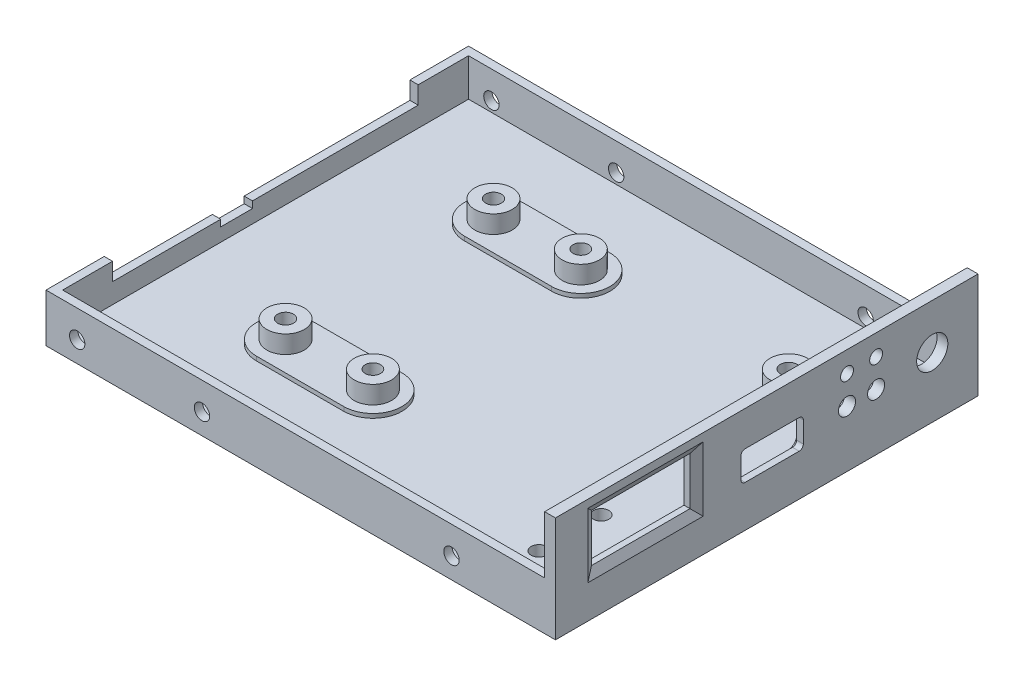
from build123d import *

# Parameters (mm, degrees)
SKETCH_1_W             = 122.5
SKETCH_1_H             = 101.6
EXTRUDE_1_DEPTH        = 25.4
SKETCH_2_W             = 117.9
SKETCH_2_H             = 97.6
CUT_EXTRUDE_1_DEPTH    = 22.857
CUT_EXTRUDE_2_REACH    = 133.758
SKETCH_5_W             = 119.9
SKETCH_5_H             = 13.8
CUT_EXTRUDE_3_REACH    = 142.716
SKETCH_6_W             = 73.5
SKETCH_6_H             = 4.25
CUT_EXTRUDE_4_REACH    = 142.716
SKETCH_7_W             = 7.65
SKETCH_7_H             = 1.6
CUT_EXTRUDE_5_REACH    = 133.758
SKETCH_8_R             = 1.85
EXTRUDE_2_DEPTH        = 1
SKETCH_11_R            = 4.5
EXTRUDE_3_DEPTH        = 4.3
CUT_EXTRUDE_6_REACH    = 106.165
SKETCH_13_R            = 1.85
SKETCH_14_R            = 4.5
SKETCH_14_R_2          = 2
EXTRUDE_5_DEPTH        = 5.3
SKETCH_15_R            = 1.55
SKETCH_15_R_2          = 2.05
CUT_EXTRUDE_7_DEPTH    = 5.3
SKETCH_16_W            = 15
SKETCH_16_H            = 7
CUT_EXTRUDE_8_DEPTH    = 5.3
FILLET_1_R             = 1
SKETCH_17_W            = 23.7
SKETCH_17_H            = 11.5
CUT_EXTRUDE_9_DEPTH    = 5.3
CHAMFER_2_SIZE         = 2
CHAMFER_2_SIZE2        = 1.154700538
SKETCH_12_R            = 1.9
CUT_EXTRUDE_10_DEPTH   = 7.843
CUT_EXTRUDE_START      = -2.543
SKETCH_18_R            = 2
CUT_EXTRUDE_11_DEPTH   = 2.543
SKETCH_19_R            = 3.75
CUT_EXTRUDE_12_DEPTH   = 10
PATTERN_LINEAR_1_COUNT = 2
PATTERN_LINEAR_1_PITCH = 50
SKETCH_30_R            = 1.85
CUT_EXTRUDE_17_DEPTH   = 10
CHAMFER_3_SIZE         = 1


with BuildPart() as part:
    # 草图1 → 凸台-拉伸1 (new body)
    with BuildSketch(Plane(origin=(0, 0, 0), x_dir=(1, 0, 0), z_dir=(0, 1, 0))):
        with Locations((-18.703264605, -13.616494845)):
            Rectangle(SKETCH_1_W, SKETCH_1_H)
    extrude(amount=EXTRUDE_1_DEPTH)

    # 草图2 → 切除-拉伸1 (cut)
    with BuildSketch(Plane(origin=(0, 25.4, 0), x_dir=(1, 0, 0), z_dir=(0, 1, 0))):
        with Locations((-19.003264605, -13.616494845)):
            Rectangle(SKETCH_2_W, SKETCH_2_H)
    extrude(amount=-CUT_EXTRUDE_1_DEPTH, mode=Mode.SUBTRACT)

    # 草图5 → 切除-拉伸2 (cut, up to next)
    with BuildSketch(Plane(origin=(0, 0, -37.183505155), x_dir=(-1, 0, 0), z_dir=(0, 0, -1)), mode=Mode.PRIVATE) as cut_extrude_2_sk1:
        with Locations((20.003264605, 18.5)):
            Rectangle(SKETCH_5_W, SKETCH_5_H)
    cut_extrude_2_tool1 = extrude(cut_extrude_2_sk1.sketch, amount=-CUT_EXTRUDE_2_REACH, mode=Mode.PRIVATE) & part.part
    add(cut_extrude_2_tool1.solids().sort_by_distance((-20.003265, 18.5, -37.183505))[0], mode=Mode.SUBTRACT)

    # 草图6 → 切除-拉伸3 (cut, up to next)
    with BuildSketch(Plane.ZY.offset(79.953264605), mode=Mode.PRIVATE) as cut_extrude_3_sk1:
        with Locations((13.666494845, 9.475)):
            Rectangle(SKETCH_6_W, SKETCH_6_H)
    cut_extrude_3_tool1 = extrude(cut_extrude_3_sk1.sketch, amount=-CUT_EXTRUDE_3_REACH, mode=Mode.PRIVATE) & part.part
    add(cut_extrude_3_tool1.solids().sort_by_distance((-79.953265, 9.475, 13.666495))[0], mode=Mode.SUBTRACT)

    # 草图7 → 切除-拉伸4 (cut, up to next)
    with BuildSketch(Plane.ZY.offset(79.953264605), mode=Mode.PRIVATE) as cut_extrude_4_sk1:
        with Locations((20.591494845, 6.55)):
            Rectangle(SKETCH_7_W, SKETCH_7_H)
    cut_extrude_4_tool1 = extrude(cut_extrude_4_sk1.sketch, amount=-CUT_EXTRUDE_4_REACH, mode=Mode.PRIVATE) & part.part
    add(cut_extrude_4_tool1.solids().sort_by_distance((-79.953265, 6.55, 20.591495))[0], mode=Mode.SUBTRACT)

    # 草图8 → 切除-拉伸5 (cut, up to next)
    with BuildSketch(Plane.XY.offset(64.416494845), mode=Mode.PRIVATE) as cut_extrude_5_sk1:
        with Locations((17.546735395, 5)):
            Circle(SKETCH_8_R)
    cut_extrude_5_tool1 = extrude(cut_extrude_5_sk1.sketch, amount=-CUT_EXTRUDE_5_REACH, mode=Mode.PRIVATE) & part.part
    # 草图8 → 切除-拉伸5 (cut, up to next)
    with BuildSketch(Plane.XY.offset(64.416494845), mode=Mode.PRIVATE) as cut_extrude_5_sk2:
        with Locations((-42.453264605, 5)):
            Circle(SKETCH_8_R)
    cut_extrude_5_tool2 = extrude(cut_extrude_5_sk2.sketch, amount=-CUT_EXTRUDE_5_REACH, mode=Mode.PRIVATE) & part.part
    # 草图8 → 切除-拉伸5 (cut, up to next)
    with BuildSketch(Plane.XY.offset(64.416494845), mode=Mode.PRIVATE) as cut_extrude_5_sk3:
        with Locations((-72.453264605, 5)):
            Circle(SKETCH_8_R)
    cut_extrude_5_tool3 = extrude(cut_extrude_5_sk3.sketch, amount=-CUT_EXTRUDE_5_REACH, mode=Mode.PRIVATE) & part.part
    cut_extrude_5_1 = cut_extrude_5_tool1.solids().sort_by_distance((17.546735, 5, 64.416495))[0]
    add(cut_extrude_5_1, mode=Mode.SUBTRACT)
    cut_extrude_5_2 = cut_extrude_5_tool2.solids().sort_by_distance((-42.453265, 5, 64.416495))[0]
    add(cut_extrude_5_2, mode=Mode.SUBTRACT)
    cut_extrude_5_3 = cut_extrude_5_tool3.solids().sort_by_distance((-72.453265, 5, 64.416495))[0]
    add(cut_extrude_5_3, mode=Mode.SUBTRACT)
    cut_extrude_5 = cut_extrude_5_1 + cut_extrude_5_2 + cut_extrude_5_3  # 切除-拉伸5 as one shape, for the pattern or mirror that repeats it

    # 镜向1: 切除-拉伸5 across plane
    add(cut_extrude_5.mirror(Plane.XY.offset(13.616494845)), mode=Mode.SUBTRACT)

    # 草图10 → 凸台-拉伸2 (add)
    with BuildSketch(Plane(origin=(0, 2.543, 0), x_dir=(1, 0, 0), z_dir=(0, 1, 0))):
        with BuildLine():
            Line((-48.953264605, 19.183505155), (-27.953264605, 19.183505155))
            ThreePointArc((-27.953264605, 19.183505155), (-20.953264605, 12.183505155), (-27.953264605, 5.183505155))
            Line((-27.953264605, 5.183505155), (-48.953264605, 5.183505155))
            ThreePointArc((-48.953264605, 5.183505155), (-55.953264605, 12.183505155), (-48.953264605, 19.183505155))
        make_face()
    extrude_2 = extrude(amount=EXTRUDE_2_DEPTH)

    # 草图11 → 凸台-拉伸3 (add)
    with BuildSketch(Plane(origin=(0, 3.543, 0), x_dir=(1, 0, 0), z_dir=(0, 1, 0))):
        with Locations(Location((-48.953264605, 12.183505155, 0), (0, 0, 90))):
            Circle(SKETCH_11_R)
        with Locations(Location((-27.953264605, 12.183505155, 0), (0, 0, 90))):
            Circle(SKETCH_11_R)
    extrude_3 = extrude(amount=EXTRUDE_3_DEPTH)

    # 草图13 → 切除-拉伸6 (cut, up to next)
    with BuildSketch(Plane(origin=(0, 7.843, 0), x_dir=(1, 0, 0), z_dir=(0, 1, 0)), mode=Mode.PRIVATE) as cut_extrude_6_sk1:
        with Locations(Location((-27.953264605, 12.183505155, 0), (0, 0, 270))):
            Circle(SKETCH_13_R)
    cut_extrude_6_tool1 = extrude(cut_extrude_6_sk1.sketch, amount=-CUT_EXTRUDE_6_REACH, mode=Mode.PRIVATE) & part.part
    cut_extrude_6 = cut_extrude_6_tool1.solids().sort_by_distance((-27.953265, 7.843, -12.183505))[0]
    add(cut_extrude_6, mode=Mode.SUBTRACT)

    # 草图14 → 凸台-拉伸5 (add)
    with BuildSketch(Plane(origin=(0, 2.543, 0), x_dir=(1, 0, 0), z_dir=(0, 1, 0))):
        with Locations(Location((22.046735395, 12.183505155, 0), (0, 0, 270))):
            Circle(SKETCH_14_R)
        with Locations(Location((22.046735395, 12.183505155, 0), (0, 0, 270))):
            Circle(SKETCH_14_R_2, mode=Mode.SUBTRACT)
    extrude(amount=EXTRUDE_5_DEPTH)

    # 草图15 → 切除-拉伸7 (cut)
    with BuildSketch(Plane(origin=(42.546735395, 0, 0), x_dir=(0, 0, -1), z_dir=(1, 0, 0))):
        with Locations((12.683505155, 20.4)):
            Circle(SKETCH_15_R)
        with Locations((12.683505155, 13.6)):
            Circle(SKETCH_15_R_2)
        with Locations((5.683505155, 20.4)):
            Circle(SKETCH_15_R)
        with Locations((5.683505155, 13.6)):
            Circle(SKETCH_15_R_2)
    extrude(amount=-CUT_EXTRUDE_7_DEPTH, mode=Mode.SUBTRACT)

    # 草图16 → 切除-拉伸8 (cut)
    with BuildSketch(Plane(origin=(42.546735395, 0, 0), x_dir=(0, 0, -1), z_dir=(1, 0, 0))):
        with Locations((-12.316494845, 13.5)):
            Rectangle(SKETCH_16_W, SKETCH_16_H)
    extrude(amount=-CUT_EXTRUDE_8_DEPTH, mode=Mode.SUBTRACT)

    # 圆角1
    fillet_1_edges = [part.edges().sort_by_distance(p)[0] for p in [
        (41.246735395, 10, 19.816494845),
        (41.246735395, 17, 19.816494845),
        (41.246735395, 17, 4.816494845),
        (41.246735395, 10, 4.816494845),
    ]]
    fillet(fillet_1_edges, radius=FILLET_1_R)

    # 草图17 → 切除-拉伸9 (cut)
    with BuildSketch(Plane(origin=(42.546735395, 0, 0), x_dir=(0, 0, -1), z_dir=(1, 0, 0))):
        with Locations((-42.766494845, 15.75)):
            Rectangle(SKETCH_17_W, SKETCH_17_H)
    extrude(amount=-CUT_EXTRUDE_9_DEPTH, mode=Mode.SUBTRACT)

    # 倒角2
    chamfer_2_edges = [part.edges().sort_by_distance(p)[0] for p in [
        (42.546735395, 15.75, 54.616494845),
        (42.546735395, 10, 42.766494845),
        (42.546735395, 15.75, 30.916494845),
        (42.546735395, 21.5, 42.766494845),
    ]]
    chamfer_2_side = [part.faces().sort_by_distance(p)[0] for p in [
        (42.546735395, 12.7, -36.136236326),
    ]]
    chamfer(chamfer_2_edges, length=CHAMFER_2_SIZE, length2=CHAMFER_2_SIZE2, reference=chamfer_2_side[0])

    # 草图12 → 切除-拉伸10 (cut)
    with BuildSketch(Plane(origin=(0, 7.843, 0), x_dir=(1, 0, 0), z_dir=(0, 1, 0))):
        with Locations(Location((-48.953264605, 12.183505155, 0), (0, 0, 270))):
            Circle(SKETCH_12_R)
    cut_extrude_10 = extrude(amount=-CUT_EXTRUDE_10_DEPTH, mode=Mode.SUBTRACT)

    # 草图18 → 切除-拉伸11 (cut)
    with BuildSketch(Plane(origin=(0, 2.543, 0), x_dir=(1, 0, 0), z_dir=(0, 1, 0)).offset(CUT_EXTRUDE_START)):
        with Locations(Location((22.046735395, 12.183505155, 0), (0, 0, 270))):
            Circle(SKETCH_18_R)
    extrude(amount=CUT_EXTRUDE_11_DEPTH, mode=Mode.SUBTRACT)

    # 草图19 → 切除-拉伸12 (cut)
    with BuildSketch(Plane.ZY.offset(-39.946735395)):
        with Locations((-26.183505155, 14.543)):
            Circle(SKETCH_19_R)
    extrude(amount=-CUT_EXTRUDE_12_DEPTH, mode=Mode.SUBTRACT)

    # 阵列(线性)1: 凸台-拉伸2, 凸台-拉伸3, 切除-拉伸6, 切除-拉伸10 ×2
    with Locations(*[(0, 0, i * PATTERN_LINEAR_1_PITCH) for i in range(1, PATTERN_LINEAR_1_COUNT)]):
        add(extrude_2)
        add(extrude_3)
        add(cut_extrude_6, mode=Mode.SUBTRACT)
        add(cut_extrude_10, mode=Mode.SUBTRACT)

    # 草图30 → 切除-拉伸17 (cut)
    with BuildSketch(Plane(origin=(0, 2.543, 0), x_dir=(1, 0, 0), z_dir=(0, 1, 0))):
        with Locations(Location((24.546735395, -50.416494845, 0), (0, 0, 270))):
            Circle(SKETCH_30_R)
        with Locations(Location((24.546735395, -35.416494845, 0), (0, 0, 270))):
            Circle(SKETCH_30_R)
    extrude(amount=-CUT_EXTRUDE_17_DEPTH, mode=Mode.SUBTRACT)

    # 倒角3
    chamfer_3_edges = [part.edges().sort_by_distance(p)[0] for p in [
        (39.946735395, 13.5, 4.816494845),
        (39.946735395, 10, 12.316494845),
        (39.946735395, 13.5, 19.816494845),
        (39.946735395, 17, 12.316494845),
        (39.946735395, 10.292893219, 5.109388064),
        (39.946735395, 10.292893219, 19.523601627),
        (39.946735395, 16.707106781, 5.109388064),
        (39.946735395, 16.707106781, 19.523601627),
    ]]
    chamfer(chamfer_3_edges, length=CHAMFER_3_SIZE)


solid = part.part
